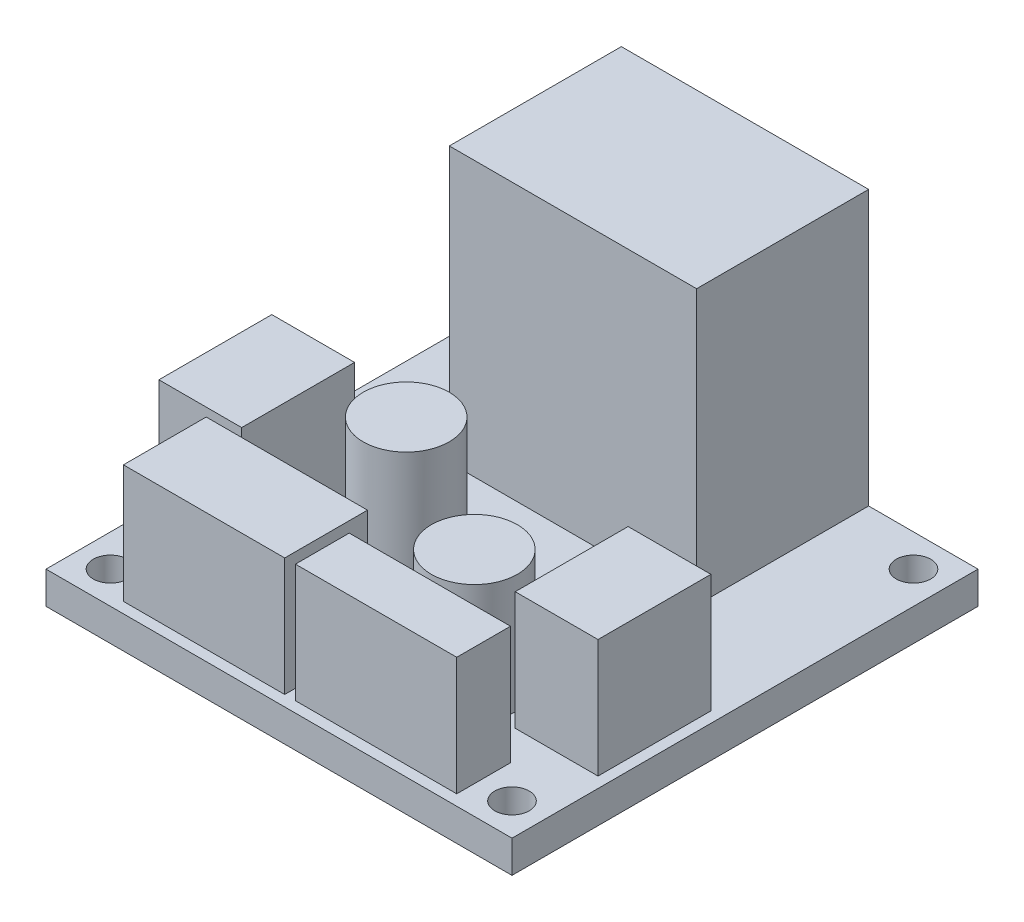
from build123d import *

# Parameters (mm, degrees)
SKETCH_1_W          = 43.34
SKETCH_1_H          = 43.34
EXTRUDE_1_DEPTH     = 28.5
CUT_EXTRUDE_1_DEPTH = 25.5
SKETCH_3_R          = 4
SKETCH_3_W          = 7.7
SKETCH_3_H          = 10.5
SKETCH_3_W_2        = 15
SKETCH_3_H_2        = 7.7
SKETCH_3_H_3        = 5
EXTRUDE_2_DEPTH     = 11
SKETCH_4_R          = 1.6
CUT_EXTRUDE_2_DEPTH = 40.867628472


with BuildPart() as part:
    # 스케치1 → 보스-돌출1 (new body)
    with BuildSketch(Plane(origin=(0, 0, 0), x_dir=(1, 0, 0), z_dir=(0, 1, 0))):
        Rectangle(SKETCH_1_W, SKETCH_1_H)
    extrude(amount=EXTRUDE_1_DEPTH)

    # 스케치2 → 컷-돌출1 (cut)
    with BuildSketch(Plane(origin=(0, 28.5, 0), x_dir=(1, 0, 0), z_dir=(0, 1, 0))):
        Polygon((-11.5, 21.67), (-11.5, 5.67), (11.5, 5.67), (11.5, 21.67), (21.67, 21.67), (21.67, -21.67), (-21.67, -21.67), (-21.67, 21.67), align=None)
    extrude(amount=-CUT_EXTRUDE_1_DEPTH, mode=Mode.SUBTRACT)

    # 스케치3 → 보스-돌출2 (add)
    with BuildSketch(Plane(origin=(0, 3, 0), x_dir=(1, 0, 0), z_dir=(0, 1, 0))):
        with Locations(Location((-6.17, -3.67, 0), (0, 0, 90))):
            Circle(SKETCH_3_R)
        with Locations(Location((7.67, -11.17, 0), (0, 0, 90))):
            Circle(SKETCH_3_R)
        with Locations((-16.82, -6.92)):
            Rectangle(SKETCH_3_W, SKETCH_3_H)
        with Locations((-7.97, -16.82)):
            Rectangle(SKETCH_3_W_2, SKETCH_3_H_2)
        with Locations((8.03, -18.17)):
            Rectangle(SKETCH_3_W_2, SKETCH_3_H_3)
        with Locations((16.82, -7.42)):
            Rectangle(SKETCH_3_W, SKETCH_3_H)
    extrude(amount=EXTRUDE_2_DEPTH)

    # 스케치4 → 컷-돌출2 (cut, through all)
    with BuildSketch(Plane(origin=(0, 3, 0), x_dir=(1, 0, 0), z_dir=(0, 1, 0))):
        with Locations(Location((-18.67, 18.67, 0), (0, 0, 270))):
            Circle(SKETCH_4_R)
        with Locations(Location((18.67, 18.67, 0), (0, 0, 270))):
            Circle(SKETCH_4_R)
        with Locations(Location((18.67, -18.67, 0), (0, 0, 270))):
            Circle(SKETCH_4_R)
        with Locations(Location((-18.67, -18.67, 0), (0, 0, 270))):
            Circle(SKETCH_4_R)
    extrude(amount=-CUT_EXTRUDE_2_DEPTH, mode=Mode.SUBTRACT)


solid = part.part
